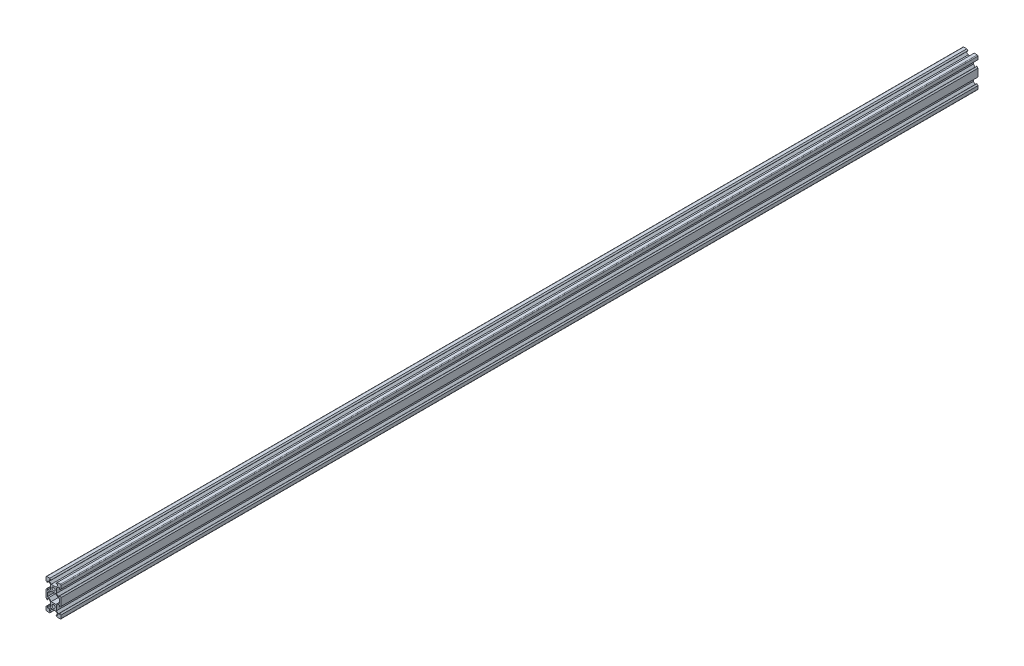
from build123d import *

# Parameters (mm, degrees)
SKETCH11_R             = 2.1
VSLOT2040_2040_1_DEPTH = 1220


with BuildPart() as part:
    # Sketch11 → Vslot2040 2040(1) (new body)
    with BuildSketch(Plane(origin=(0, 0, 610), x_dir=(-1, 0, 0), z_dir=(0, 0, -1))):
        with BuildLine():
            Line((5.5, -18.2), (3.607842712, -18.2))
            ThreePointArc((3.607842712, -18.2), (3.423066806, -18.323463314), (3.466421356, -18.541421356))
            Line((3.466421356, -18.541421356), (4.925, -20))
            Line((4.925, -20), (9, -20))
            ThreePointArc((9, -20), (9.707106781, -19.707106781), (10, -19))
            Line((10, -19), (10, -14.925))
            Line((10, -14.925), (8.541421356, -13.466421356))
            ThreePointArc((8.541421356, -13.466421356), (8.323463314, -13.423066806), (8.2, -13.607842712))
            Line((8.2, -13.607842712), (8.2, -15.5))
            Line((8.2, -15.5), (6.275, -15.5))
            Line((6.275, -15.5), (3.9, -13.125))
            Line((3.9, -13.125), (3.9, -6.875))
            Line((3.9, -6.875), (6.275, -4.5))
            Line((6.275, -4.5), (8.2, -4.5))
            Line((8.2, -4.5), (8.2, -6.392157288))
            ThreePointArc((8.2, -6.392157288), (8.323463314, -6.576933194), (8.541421356, -6.533578644))
            Line((8.541421356, -6.533578644), (10, -5.075))
            Line((10, -5.075), (10, 5.075))
            Line((10, 5.075), (8.541421356, 6.533578644))
            ThreePointArc((8.541421356, 6.533578644), (8.323463314, 6.576933194), (8.2, 6.392157288))
            Line((8.2, 6.392157288), (8.2, 4.5))
            Line((8.2, 4.5), (6.275, 4.5))
            Line((6.275, 4.5), (3.9, 6.875))
            Line((3.9, 6.875), (3.9, 13.125))
            Line((3.9, 13.125), (6.275, 15.5))
            Line((6.275, 15.5), (8.2, 15.5))
            Line((8.2, 15.5), (8.2, 13.607842712))
            ThreePointArc((8.2, 13.607842712), (8.323463314, 13.423066806), (8.541421356, 13.466421356))
            Line((8.541421356, 13.466421356), (10, 14.925))
            Line((10, 14.925), (10, 19))
            ThreePointArc((10, 19), (9.707106781, 19.707106781), (9, 20))
            Line((9, 20), (4.925, 20))
            Line((4.925, 20), (3.466421356, 18.541421356))
            ThreePointArc((3.466421356, 18.541421356), (3.423066806, 18.323463314), (3.607842712, 18.2))
            Line((3.607842712, 18.2), (5.5, 18.2))
            Line((5.5, 18.2), (5.5, 16.275))
            Line((5.5, 16.275), (3.125, 13.9))
            Line((3.125, 13.9), (-3.125, 13.9))
            Line((-3.125, 13.9), (-5.5, 16.275))
            Line((-5.5, 16.275), (-5.5, 18.2))
            Line((-5.5, 18.2), (-3.607842712, 18.2))
            ThreePointArc((-3.607842712, 18.2), (-3.423066806, 18.323463314), (-3.466421356, 18.541421356))
            Line((-3.466421356, 18.541421356), (-4.925, 20))
            Line((-4.925, 20), (-9, 20))
            ThreePointArc((-9, 20), (-9.707106781, 19.707106781), (-10, 19))
            Line((-10, 19), (-10, 14.925))
            Line((-10, 14.925), (-8.541421356, 13.466421356))
            ThreePointArc((-8.541421356, 13.466421356), (-8.323463314, 13.423066806), (-8.2, 13.607842712))
            Line((-8.2, 13.607842712), (-8.2, 15.5))
            Line((-8.2, 15.5), (-6.275, 15.5))
            Line((-6.275, 15.5), (-3.9, 13.125))
            Line((-3.9, 13.125), (-3.9, 6.875))
            Line((-3.9, 6.875), (-6.275, 4.5))
            Line((-6.275, 4.5), (-8.2, 4.5))
            Line((-8.2, 4.5), (-8.2, 6.392157288))
            ThreePointArc((-8.2, 6.392157288), (-8.323463314, 6.576933194), (-8.541421356, 6.533578644))
            Line((-8.541421356, 6.533578644), (-10, 5.075))
            Line((-10, 5.075), (-10, -5.075))
            Line((-10, -5.075), (-8.541421356, -6.533578644))
            ThreePointArc((-8.541421356, -6.533578644), (-8.323463314, -6.576933194), (-8.2, -6.392157288))
            Line((-8.2, -6.392157288), (-8.2, -4.5))
            Line((-8.2, -4.5), (-6.275, -4.5))
            Line((-6.275, -4.5), (-3.9, -6.875))
            Line((-3.9, -6.875), (-3.9, -13.125))
            Line((-3.9, -13.125), (-6.275, -15.5))
            Line((-6.275, -15.5), (-8.2, -15.5))
            Line((-8.2, -15.5), (-8.2, -13.607842712))
            ThreePointArc((-8.2, -13.607842712), (-8.323463314, -13.423066806), (-8.541421356, -13.466421356))
            Line((-8.541421356, -13.466421356), (-10, -14.925))
            Line((-10, -14.925), (-10, -19))
            ThreePointArc((-10, -19), (-9.707106781, -19.707106781), (-9, -20))
            Line((-9, -20), (-4.925, -20))
            Line((-4.925, -20), (-3.466421356, -18.541421356))
            ThreePointArc((-3.466421356, -18.541421356), (-3.423066806, -18.323463314), (-3.607842712, -18.2))
            Line((-3.607842712, -18.2), (-5.5, -18.2))
            Line((-5.5, -18.2), (-5.5, -16.275))
            Line((-5.5, -16.275), (-3.125, -13.9))
            Line((-3.125, -13.9), (3.125, -13.9))
            Line((3.125, -13.9), (5.5, -16.275))
            Line((5.5, -16.275), (5.5, -18.2))
        make_face()
        with Locations((0, -10)):
            Circle(SKETCH11_R, mode=Mode.SUBTRACT)
        with Locations((0, 10)):
            Circle(SKETCH11_R, mode=Mode.SUBTRACT)
        Polygon((3.125, 6.1), (6.275, 2.95), (8.2, 2.95), (8.2, -2.95), (6.275, -2.95), (3.125, -6.1), (-3.125, -6.1), (-6.275, -2.95), (-8.2, -2.95), (-8.2, 2.95), (-6.275, 2.95), (-3.125, 6.1), align=None, mode=Mode.SUBTRACT)
    extrude(amount=VSLOT2040_2040_1_DEPTH)


solid = part.part
